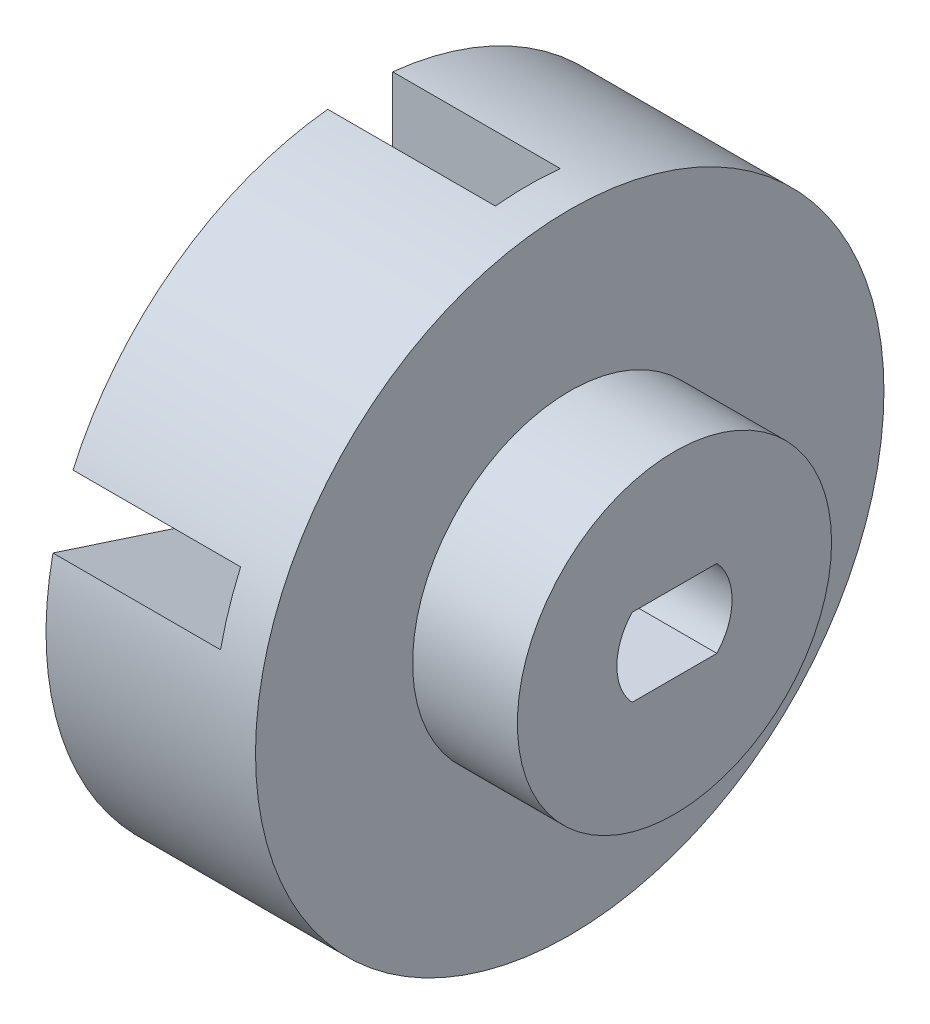
from build123d import *

# Parameters (mm, degrees)
SKETCH_1_R          = 15
EXTRUDE_1_DEPTH     = 10
SKETCH_2_R          = 7.5
EXTRUDE_2_DEPTH     = 5
CUT_EXTRUDE_1_DEPTH = 5
SKETCH_4_R          = 2.7
CUT_EXTRUDE_2_DEPTH = 5
SKETCH_5_R          = 1.05
CUT_EXTRUDE_3_DEPTH = 24.452078799
SKETCH_6_W          = 3.1
SKETCH_6_H          = 14.99101371
CUT_EXTRUDE_4_DEPTH = 8


with BuildPart() as part:
    # 草图1 → 凸台-拉伸1 (new body)
    with BuildSketch(Plane(origin=(0, 0, 0), x_dir=(0, 0, -1), z_dir=(1, 0, 0))):
        Circle(SKETCH_1_R)
    extrude(amount=EXTRUDE_1_DEPTH)

    # 草图2 → 凸台-拉伸2 (add)
    with BuildSketch(Plane(origin=(10, 0, 0), x_dir=(0, 0, -1), z_dir=(1, 0, 0))):
        Circle(SKETCH_2_R)
    extrude(amount=EXTRUDE_2_DEPTH)

    # 草图3 → 切除-拉伸1 (cut)
    with BuildSketch(Plane(origin=(15, 0, 0), x_dir=(0, 0, -1), z_dir=(1, 0, 0))):
        with BuildLine():
            Line((-2.025561651, 1.86), (2.025561651, 1.86))
            ThreePointArc((2.025561651, 1.86), (2.75, 0), (2.025561651, -1.86))
            Line((2.025561651, -1.86), (-2.025561651, -1.86))
            ThreePointArc((-2.025561651, -1.86), (-2.75, 0), (-2.025561651, 1.86))
        make_face()
    extrude(amount=-CUT_EXTRUDE_1_DEPTH, mode=Mode.SUBTRACT)

    # 草图4 → 切除-拉伸2 (cut)
    with BuildSketch(Plane.ZY):
        Circle(SKETCH_4_R)
    extrude(amount=-CUT_EXTRUDE_2_DEPTH, mode=Mode.SUBTRACT)

    # 草图5 → 切除-拉伸3 (cut, through all)
    with BuildSketch(Plane.ZY.offset(-5)):
        Circle(SKETCH_5_R)
    extrude(amount=-CUT_EXTRUDE_3_DEPTH, mode=Mode.SUBTRACT)

    # 草图6 → 切除-拉伸4 (cut)
    with BuildSketch(Plane.ZY):
        Polygon((18.533607515, 7.651700572), (19.491560198, 4.703425371), (5.234258923, 0.070947372), (4.27630624, 3.019222572), align=None)
        with Locations((0, 12.495506855)):
            Rectangle(SKETCH_6_W, SKETCH_6_H)
        Polygon((13.004399379, -15.262002685), (10.496446696, -17.084136968), (1.68494992, -4.956152113), (4.192902603, -3.134017831), align=None)
        Polygon((-10.496446696, -17.084136968), (-13.004399379, -15.262002685), (-4.192902603, -3.134017831), (-1.68494992, -4.956152113), align=None)
        Polygon((-19.491560198, 4.703425371), (-18.533607515, 7.651700572), (-4.27630624, 3.019222572), (-5.234258923, 0.070947372), align=None)
    extrude(amount=-CUT_EXTRUDE_4_DEPTH, mode=Mode.SUBTRACT)


solid = part.part
